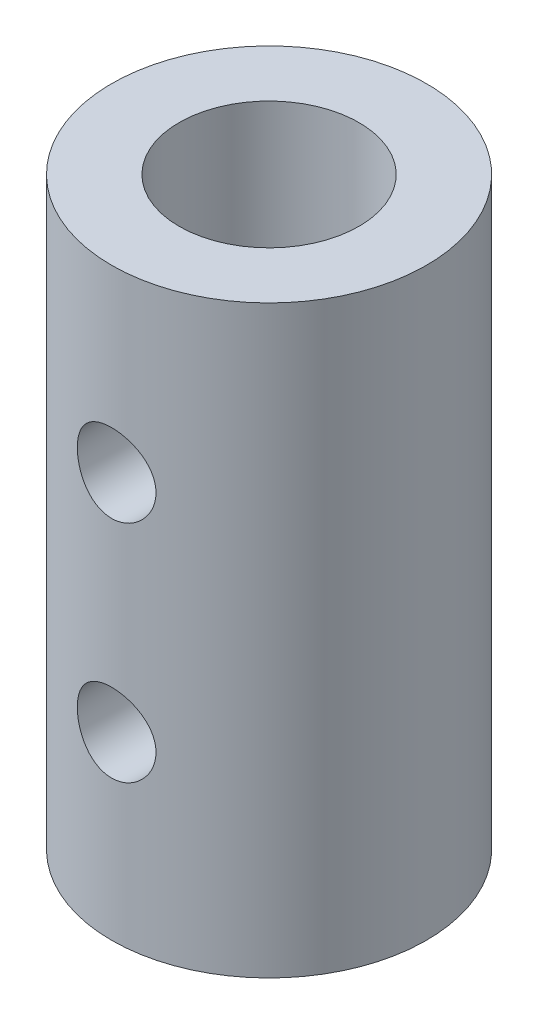
from build123d import *

# Parameters (mm, degrees)
ESQUISSE1_R                  = 35
ESQUISSE1_R_2                = 20
BOSS_EXTRU_1_DEPTH           = 130
ENL_V_MAT_EXTRU_1_DEPTH      = 140.104277432
ENL_V_MAT_EXTRU_1_DEPTH_BACK = 140.104277432
ESQUISSE2_R                  = 8.75
ESQUISSE4_R                  = 7.5
ENL_V_MAT_EXTRU_2_DEPTH      = 140.104277576


with BuildPart() as part:
    # Esquisse1 → Boss.-Extru.1 (new body)
    with BuildSketch(Plane(origin=(0, 0, 0), x_dir=(1, 0, 0), z_dir=(0, 1, 0))):
        with Locations(Location((0, 0, 0), (0, 0, 270))):
            Circle(ESQUISSE1_R)
        with Locations(Location((0, 0, 0), (0, 0, 270))):
            Circle(ESQUISSE1_R_2, mode=Mode.SUBTRACT)
    extrude(amount=BOSS_EXTRU_1_DEPTH)

    # Esquisse2 → Enlèv. mat.-Extru.1 (cut, two sides: drawn at the far end of the back side and taken through both)
    with BuildSketch(Plane.XY.offset(-ENL_V_MAT_EXTRU_1_DEPTH_BACK)):
        with Locations((0, 90)):
            Circle(ESQUISSE2_R)
        with Locations((0, 40)):
            Circle(ESQUISSE2_R)
    extrude(amount=ENL_V_MAT_EXTRU_1_DEPTH + ENL_V_MAT_EXTRU_1_DEPTH_BACK, mode=Mode.SUBTRACT)

    # Esquisse4 → Enlèv. mat.-Extru.2 (cut, through all)
    with BuildSketch(Plane(origin=(0, 0, 0), x_dir=(0, 0, -1), z_dir=(1, 0, 0))):
        with Locations((0, 65)):
            Circle(ESQUISSE4_R)
    extrude(amount=-ENL_V_MAT_EXTRU_2_DEPTH, mode=Mode.SUBTRACT)


solid = part.part
